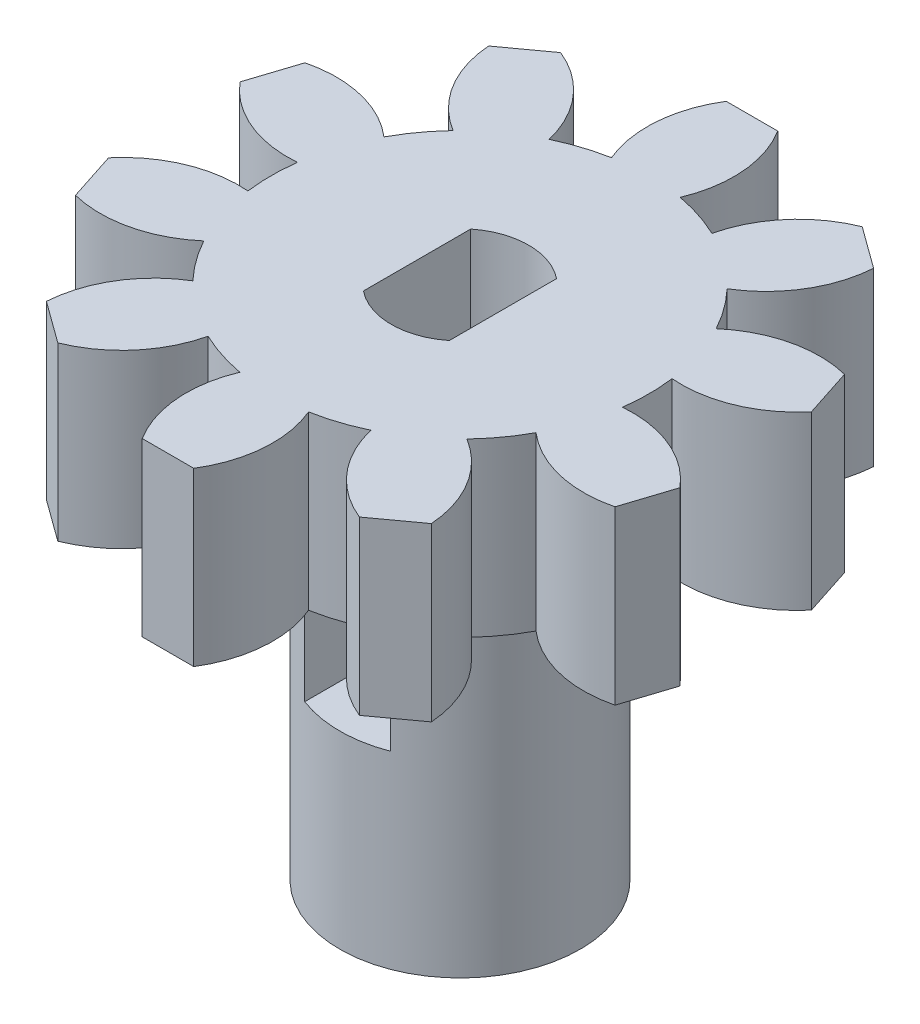
from build123d import *

# Parameters (mm, degrees)
SKETCH_1_R                      = 5.5
EXTRUDE_1_DEPTH                 = 5
EXTRUDE_START                   = -5
EXTRUDE_2_DEPTH                 = 5
SKETCH_3_R                      = 3.5
EXTRUDE_3_DEPTH                 = 10
CUT_EXTRUDE_1_DEPTH             = 20.141619155
CUT_EXTRUDE_2_REACH             = 17.537
SKETCH_5_W                      = 2.5
SKETCH_5_H                      = 4.5
CUT_EXTRUDE_2_DIRECTION_2_REACH = 17.537


with BuildPart() as part:
    # 草图1 → 凸台-拉伸1 (new body)
    with BuildSketch(Plane(origin=(0, 0, 0), x_dir=(1, 0, 0), z_dir=(0, 1, 0))):
        with Locations(Location((0, 0, 0), (0, 0, 270))):
            Circle(SKETCH_1_R)
    extrude(amount=EXTRUDE_1_DEPTH)

    # 草图2 → 凸台-拉伸2 (add)
    with BuildSketch(Plane(origin=(0, 5, 0), x_dir=(-1, 0, 0), z_dir=(0, 1, 0)).offset(EXTRUDE_START)):
        with BuildLine():
            Line((-4.389411899, -7.317483391), (-5.60293739, -6.435805513))
            ThreePointArc((-5.60293739, -6.435805513), (-5.11774735, -4.915167527), (-3.987951794, -3.787643132))
            ThreePointArc((-3.987951794, -3.787643132), (-3.232818888, -4.449593469), (-2.369917805, -4.963213636))
            ThreePointArc((-2.369917805, -4.963213636), (-3.093131201, -6.386137262), (-4.389411899, -7.317483391))
        make_face()
        with BuildLine():
            Line((-7.852217643, -3.339936839), (-8.315743134, -1.913352065))
            ThreePointArc((-8.315743134, -1.913352065), (-7.029407564, -0.968317642), (-5.452641547, -0.720208411))
            ThreePointArc((-5.452641547, -0.720208411), (-5.23081084, -1.699593469), (-4.834607559, -2.622321444))
            ThreePointArc((-4.834607559, -2.622321444), (-6.256073009, -3.34839667), (-7.852217643, -3.339936839))
        make_face()
        with BuildLine():
            Line((-8.315743134, 1.913352065), (-7.852217643, 3.339936839))
            ThreePointArc((-7.852217643, 3.339936839), (-6.256073009, 3.34839667), (-4.834607559, 2.622321444))
            ThreePointArc((-4.834607559, 2.622321444), (-5.23081084, 1.699593469), (-5.452641547, 0.720208411))
            ThreePointArc((-5.452641547, 0.720208411), (-7.029407564, 0.968317642), (-8.315743134, 1.913352065))
        make_face()
        with BuildLine():
            Line((-5.60293739, 6.435805513), (-4.389411899, 7.317483391))
            ThreePointArc((-4.389411899, 7.317483391), (-3.093131201, 6.386137262), (-2.369917805, 4.963213636))
            ThreePointArc((-2.369917805, 4.963213636), (-3.232818888, 4.449593469), (-3.987951794, 3.787643132))
            ThreePointArc((-3.987951794, 3.787643132), (-5.11774735, 4.915167527), (-5.60293739, 6.435805513))
        make_face()
        with BuildLine():
            Line((-0.75, 8.5), (0.75, 8.5))
            ThreePointArc((0.75, 8.5), (1.251281594, 6.984590476), (1, 5.408326913))
            ThreePointArc((1, 5.408326913), (0, 5.5), (-1, 5.408326913))
            ThreePointArc((-1, 5.408326913), (-1.251281594, 6.984590476), (-0.75, 8.5))
        make_face()
        with BuildLine():
            Line((4.389411899, 7.317483391), (5.60293739, 6.435805513))
            ThreePointArc((5.60293739, 6.435805513), (5.11774735, 4.915167527), (3.987951794, 3.787643132))
            ThreePointArc((3.987951794, 3.787643132), (3.232818888, 4.449593469), (2.369917805, 4.963213636))
            ThreePointArc((2.369917805, 4.963213636), (3.093131201, 6.386137262), (4.389411899, 7.317483391))
        make_face()
        with BuildLine():
            Line((0.75, -8.5), (-0.75, -8.5))
            ThreePointArc((-0.75, -8.5), (-1.251281594, -6.984590476), (-1, -5.408326913))
            ThreePointArc((-1, -5.408326913), (0, -5.5), (1, -5.408326913))
            ThreePointArc((1, -5.408326913), (1.251281594, -6.984590476), (0.75, -8.5))
        make_face()
        with BuildLine():
            Line((7.852217643, 3.339936839), (8.315743134, 1.913352065))
            ThreePointArc((8.315743134, 1.913352065), (7.029407564, 0.968317642), (5.452641547, 0.720208411))
            ThreePointArc((5.452641547, 0.720208411), (5.23081084, 1.699593469), (4.834607559, 2.622321444))
            ThreePointArc((4.834607559, 2.622321444), (6.256073009, 3.34839667), (7.852217643, 3.339936839))
        make_face()
        with BuildLine():
            Line((8.315743134, -1.913352065), (7.852217643, -3.339936839))
            ThreePointArc((7.852217643, -3.339936839), (6.256073009, -3.34839667), (4.834607559, -2.622321444))
            ThreePointArc((4.834607559, -2.622321444), (5.23081084, -1.699593469), (5.452641547, -0.720208411))
            ThreePointArc((5.452641547, -0.720208411), (7.029407564, -0.968317642), (8.315743134, -1.913352065))
        make_face()
        with BuildLine():
            Line((5.60293739, -6.435805513), (4.389411899, -7.317483391))
            ThreePointArc((4.389411899, -7.317483391), (3.093131201, -6.386137262), (2.369917805, -4.963213636))
            ThreePointArc((2.369917805, -4.963213636), (3.232818888, -4.449593469), (3.987951794, -3.787643132))
            ThreePointArc((3.987951794, -3.787643132), (5.11774735, -4.915167527), (5.60293739, -6.435805513))
        make_face()
    extrude(amount=EXTRUDE_2_DEPTH)

    # 草图3 → 凸台-拉伸3 (add)
    with BuildSketch(Plane.XZ):
        with Locations(Location((0, 0, 0), (0, 0, 90))):
            Circle(SKETCH_3_R)
    extrude(amount=EXTRUDE_3_DEPTH)

    # 草图4 → 切除-拉伸1 (cut, through all)
    with BuildSketch(Plane(origin=(0, 5, 0), x_dir=(-1, 0, 0), z_dir=(0, 1, 0))):
        with BuildLine():
            Line((1.25, 1.5612495), (1.25, -1.5612495))
            ThreePointArc((1.25, -1.5612495), (0, -2), (-1.25, -1.5612495))
            Line((-1.25, -1.5612495), (-1.25, 1.5612495))
            ThreePointArc((-1.25, 1.5612495), (0, 2), (1.25, 1.5612495))
        make_face()
    extrude(amount=-CUT_EXTRUDE_1_DEPTH, mode=Mode.SUBTRACT)

    # 草图5 → 切除-拉伸2 (cut, up to next)
    with BuildSketch(Plane.XY, mode=Mode.PRIVATE) as cut_extrude_2_sk1:
        with Locations((0, -2.25)):
            Rectangle(SKETCH_5_W, SKETCH_5_H)
    cut_extrude_2_tool1 = extrude(cut_extrude_2_sk1.sketch, amount=-CUT_EXTRUDE_2_REACH, mode=Mode.PRIVATE) & part.part
    add(cut_extrude_2_tool1.solids().sort_by_distance((0, -2.25, 0))[0], mode=Mode.SUBTRACT)

    # 草图5 → 切除-拉伸2 direction 2 (cut, up to next)
    with BuildSketch(Plane.XY, mode=Mode.PRIVATE) as cut_extrude_2_direction_2_sk1:
        with Locations((0, -2.25)):
            Rectangle(SKETCH_5_W, SKETCH_5_H)
    cut_extrude_2_direction_2_tool1 = extrude(cut_extrude_2_direction_2_sk1.sketch, amount=CUT_EXTRUDE_2_DIRECTION_2_REACH, mode=Mode.PRIVATE) & part.part
    add(cut_extrude_2_direction_2_tool1.solids().sort_by_distance((0, -2.25, 0))[0], mode=Mode.SUBTRACT)


solid = part.part
